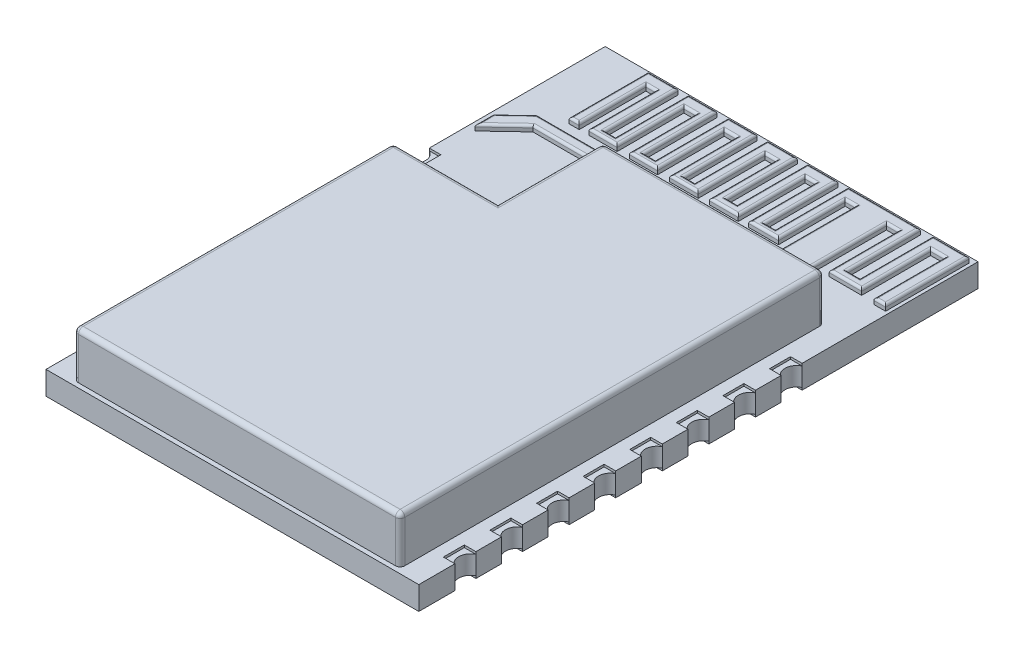
from build123d import *

# Parameters (mm, degrees)
EXTRUDE_1_DEPTH     = 1
CUT_EXTRUDE_1_DEPTH = 0.1
SKETCH_3_W          = 0.9999999999999991
SKETCH_3_H          = 0.9000000000000012
SKETCH_3_H_2        = 0.9000000000000021
SKETCH_3_W_2        = 1.0000000000000009
SKETCH_3_H_3        = 0.9000000000000017
SKETCH_3_H_4        = 0.9000000000000015
CUT_EXTRUDE_2_DEPTH = 0.1
CUT_EXTRUDE_3_DEPTH = 0.1
SKETCH_12_R         = 0.2
SKETCH_12_R_2       = 0.20000000000000023
SKETCH_12_R_3       = 0.1999999999999999
SKETCH_12_R_4       = 0.2000000000000001
SKETCH_12_R_5       = 0.19999999999999996
SKETCH_12_R_6       = 0.20000000000000007
CUT_EXTRUDE_4_DEPTH = 0.1
SKETCH_13_W         = 4.700000000000001
SKETCH_13_H         = 4.7
EXTRUDE_2_DEPTH     = 0.5
CUT_EXTRUDE_5_DEPTH = 0.1
SKETCH_16_R         = 0.2
SKETCH_16_R_2       = 0.19999999999999982
SKETCH_16_R_3       = 0.20000000000000004
SKETCH_16_R_4       = 0.19999999999999998
CUT_EXTRUDE_6_DEPTH = 0.25
EXTRUDE_4_DEPTH     = 2
CUT_EXTRUDE_7_DEPTH = 2
SKETCH_19_W         = 14
SKETCH_19_H         = 1.002469933908639
EXTRUDE_5_DEPTH     = 2
EXTRUDE_7_DEPTH     = 0.25
FILLET_1_R          = 0.2
FILLET_2_R          = 0.1


with BuildPart() as part:
    # 草圖1 → 填料-伸長1 (new body)
    with BuildSketch(Plane(origin=(0, 0, 0), x_dir=(1, 0, 0), z_dir=(0, 1, 0))):
        Polygon((-8, 12.000000000000002), (8, 12.000000000000002), (8.000000000000004, -11.999999999999998), (-7.9999999999999964, -11.999999999999998), align=None)
    extrude(amount=EXTRUDE_1_DEPTH)

    # 草圖2 → 除料-伸長1 (cut)
    with BuildSketch(Plane(origin=(0, 1, 0), x_dir=(1, 0, 0), z_dir=(0, 1, 0))):
        Polygon((-7.999999999999998, 2.4499977713717627), (-7.999999999999998, 1.5499977713717676), (-7.502985717330638, 1.5499977713717659), (-7.502985717330638, 2.449997771371764), align=None)
        Polygon((-7.999999999999998, 0.44999777137176267), (-7.999999999999998, -0.45000222862823236), (-7.502985717330638, -0.4500022286282341), (-7.502985717330638, 0.44999777137176394), align=None)
        Polygon((-7.999999999999998, -1.5500022286282373), (-7.999999999999998, -2.4500022286282324), (-7.502985717330637, -2.450002228628234), (-7.502985717330637, -1.550002228628236), align=None)
        Polygon((-7.999999999999997, -3.5500022286282373), (-7.999999999999997, -4.450002228628234), (-7.502985717330637, -4.450002228628234), (-7.502985717330637, -3.550002228628236), align=None)
        Polygon((-7.999999999999997, -5.550002228628239), (-7.999999999999997, -6.450002228628234), (-7.502985717330637, -6.450002228628234), (-7.502985717330637, -5.5500022286282364), align=None)
        Polygon((-7.999999999999997, -7.550002228628239), (-7.999999999999997, -8.450002228628234), (-7.5029857173306365, -8.450002228628234), (-7.5029857173306365, -7.5500022286282364), align=None)
        Polygon((-7.5029857173306365, -9.550002228628236), (-7.9999999999999964, -9.550002228628237), (-7.9999999999999964, -10.450002228628234), (-7.5029857173306365, -10.450002228628234), align=None)
        Polygon((7.5029857173306365, -10.450002228628234), (8.000000000000004, -10.450002228628232), (8.000000000000004, -9.550002228628237), (7.5029857173306365, -9.550002228628236), align=None)
        Polygon((7.5029857173306365, -8.450002228628234), (8.000000000000004, -8.450002228628232), (8.000000000000004, -7.550002228628238), (7.5029857173306365, -7.5500022286282364), align=None)
        Polygon((7.502985717330636, -6.450002228628234), (8.000000000000004, -6.450002228628232), (8.000000000000002, -5.550002228628238), (7.502985717330636, -5.5500022286282364), align=None)
        Polygon((7.502985717330636, -4.450002228628234), (8.000000000000002, -4.450002228628232), (8.000000000000002, -3.5500022286282373), (7.502985717330636, -3.550002228628236), align=None)
        Polygon((7.502985717330636, -2.450002228628234), (8.000000000000002, -2.4500022286282324), (8.000000000000002, -1.5500022286282373), (7.502985717330636, -1.550002228628236), align=None)
        Polygon((7.502985717330635, -0.4500022286282341), (8.000000000000002, -0.45000222862823236), (8.000000000000002, 0.44999777137176267), (7.502985717330635, 0.44999777137176394), align=None)
        Polygon((7.502985717330635, 3.549997771371766), (8.000000000000002, 3.5499977713717676), (8.000000000000002, 4.449997771371764), (7.502985717330635, 4.449997771371764), align=None)
        Polygon((7.502985717330635, 1.5499977713717659), (8.000000000000002, 1.5499977713717676), (8.000000000000002, 2.4499977713717627), (7.502985717330635, 2.449997771371764), align=None)
        Polygon((-7.502985717330638, 4.449997771371764), (-7.502985717330638, 3.549997771371766), (-8.002985717330638, 3.5499977713717676), (-8.002985717330638, 4.449997771371763), align=None)
    extrude(amount=-CUT_EXTRUDE_1_DEPTH, mode=Mode.SUBTRACT)

    # 草圖3 → 除料-伸長2 (cut)
    with BuildSketch(Plane.XZ):
        with Locations((7.5000000000000036, 7.999999999999998)):
            Rectangle(SKETCH_3_W, SKETCH_3_H)
        with Locations((7.5000000000000036, 9.999999999999998)):
            Rectangle(SKETCH_3_W, SKETCH_3_H_2)
        with Locations((7.5000000000000036, 5.999999999999998)):
            Rectangle(SKETCH_3_W_2, SKETCH_3_H)
        with Locations((7.5000000000000036, 3.9999999999999982)):
            Rectangle(SKETCH_3_W_2, SKETCH_3_H_3)
        with Locations((7.500000000000002, 1.9999999999999982)):
            Rectangle(SKETCH_3_W, SKETCH_3_H)
        with Locations((7.500000000000002, -1.75e-15)):
            Rectangle(SKETCH_3_W, SKETCH_3_H_4)
        with Locations((7.500000000000002, -2.0000000000000018)):
            Rectangle(SKETCH_3_W, SKETCH_3_H)
        with Locations((7.500000000000002, -4.000000000000002)):
            Rectangle(SKETCH_3_W, SKETCH_3_H_2)
        with Locations((-7.5000000000000036, 9.999999999999998)):
            Rectangle(SKETCH_3_W, SKETCH_3_H_2)
        with Locations((-7.500000000000002, -4.000000000000002)):
            Rectangle(SKETCH_3_W, SKETCH_3_H_2)
        with Locations((-7.500000000000002, -2.0000000000000018)):
            Rectangle(SKETCH_3_W, SKETCH_3_H)
        with Locations((-7.500000000000002, -1.75e-15)):
            Rectangle(SKETCH_3_W, SKETCH_3_H_4)
        with Locations((-7.500000000000002, 1.9999999999999982)):
            Rectangle(SKETCH_3_W, SKETCH_3_H)
        with Locations((-7.5000000000000036, 3.9999999999999982)):
            Rectangle(SKETCH_3_W_2, SKETCH_3_H_3)
        with Locations((-7.5000000000000036, 5.999999999999998)):
            Rectangle(SKETCH_3_W_2, SKETCH_3_H)
        with Locations((-7.5000000000000036, 7.999999999999998)):
            Rectangle(SKETCH_3_W, SKETCH_3_H)
    extrude(amount=-CUT_EXTRUDE_2_DEPTH, mode=Mode.SUBTRACT)

    # 草圖8 → 除料-伸長3 (cut)
    with BuildSketch(Plane(origin=(0, 1, 0), x_dir=(1, 0, 0), z_dir=(0, 1, 0))):
        Polygon((-0.9999999999999989, 0.6000000000000024), (3.7000000000000015, 0.6000000000000024), (3.700000000000002, -4.099999999999998), (-0.9999999999999983, -4.099999999999998), align=None)
    extrude(amount=-CUT_EXTRUDE_3_DEPTH, mode=Mode.SUBTRACT)

    # 草圖12 → 除料-伸長4 (cut)
    with BuildSketch(Plane(origin=(0, 0.9, 0), x_dir=(1, 0, 0), z_dir=(0, 1, 0))):
        with Locations(Location((-0.5099999999999989, -3.6499999999999977, 0), (0, 0, 270))):
            Circle(SKETCH_12_R)
        with Locations(Location((0.4200000000000011, -3.6499999999999977, 0), (0, 0, 270))):
            Circle(SKETCH_12_R)
        with Locations(Location((1.3500000000000012, -3.6499999999999977, 0), (0, 0, 270))):
            Circle(SKETCH_12_R)
        with Locations(Location((2.2800000000000007, -3.6499999999999977, 0), (0, 0, 270))):
            Circle(SKETCH_12_R_2)
        with Locations(Location((3.210000000000001, -3.6499999999999977, 0), (0, 0, 270))):
            Circle(SKETCH_12_R_2)
        with Locations(Location((-0.509999999999999, -2.7199999999999975, 0), (0, 0, 270))):
            Circle(SKETCH_12_R_3)
        with Locations(Location((0.420000000000001, -2.7199999999999975, 0), (0, 0, 270))):
            Circle(SKETCH_12_R_3)
        with Locations(Location((1.350000000000001, -2.7199999999999975, 0), (0, 0, 270))):
            Circle(SKETCH_12_R_3)
        with Locations(Location((2.2800000000000007, -2.7199999999999975, 0), (0, 0, 270))):
            Circle(SKETCH_12_R_4)
        with Locations(Location((3.210000000000001, -2.7199999999999975, 0), (0, 0, 270))):
            Circle(SKETCH_12_R_4)
        with Locations(Location((-0.5099999999999991, -1.7899999999999978, 0), (0, 0, 270))):
            Circle(SKETCH_12_R_5)
        with Locations(Location((0.4200000000000008, -1.7899999999999978, 0), (0, 0, 270))):
            Circle(SKETCH_12_R_6)
        with Locations(Location((1.350000000000001, -1.7899999999999978, 0), (0, 0, 270))):
            Circle(SKETCH_12_R)
        with Locations(Location((2.2800000000000002, -1.7899999999999978, 0), (0, 0, 270))):
            Circle(SKETCH_12_R_2)
        with Locations(Location((3.2100000000000004, -1.7899999999999978, 0), (0, 0, 270))):
            Circle(SKETCH_12_R_2)
        with Locations(Location((-0.5099999999999993, -0.8599999999999979, 0), (0, 0, 270))):
            Circle(SKETCH_12_R_6)
        with Locations(Location((0.4200000000000007, -0.8599999999999979, 0), (0, 0, 270))):
            Circle(SKETCH_12_R_5)
        with Locations(Location((1.3500000000000008, -0.8599999999999979, 0), (0, 0, 270))):
            Circle(SKETCH_12_R)
        with Locations(Location((2.2800000000000002, -0.8599999999999979, 0), (0, 0, 270))):
            Circle(SKETCH_12_R_2)
        with Locations(Location((3.2100000000000004, -0.8599999999999979, 0), (0, 0, 270))):
            Circle(SKETCH_12_R_2)
        with Locations(Location((-0.5099999999999995, 0.07000000000000235, 0), (0, 0, 270))):
            Circle(SKETCH_12_R_6)
        with Locations(Location((0.4200000000000006, 0.07000000000000235, 0), (0, 0, 270))):
            Circle(SKETCH_12_R_5)
        with Locations(Location((1.3500000000000008, 0.07000000000000235, 0), (0, 0, 270))):
            Circle(SKETCH_12_R)
        with Locations(Location((2.2800000000000002, 0.07000000000000235, 0), (0, 0, 270))):
            Circle(SKETCH_12_R_2)
        with Locations(Location((3.2100000000000004, 0.07000000000000235, 0), (0, 0, 270))):
            Circle(SKETCH_12_R_2)
    extrude(amount=-CUT_EXTRUDE_4_DEPTH, mode=Mode.SUBTRACT)

    # 草圖13 → 填料-伸長2 (add)
    with BuildSketch(Plane(origin=(0, 1, 0), x_dir=(1, 0, 0), z_dir=(0, 1, 0))):
        with Locations((1.3500000000000016, -1.7499999999999978)):
            Rectangle(SKETCH_13_W, SKETCH_13_H)
    extrude(amount=-EXTRUDE_2_DEPTH)

    # 草圖15 → 除料-伸長5 (cut)
    with BuildSketch(Plane.XZ):
        Polygon((1.0000000000000018, -0.6000000000000014), (-3.6999999999999984, -0.6000000000000021), (-3.6999999999999984, 4.099999999999997), (1.000000000000002, 4.099999999999998), align=None)
    extrude(amount=-CUT_EXTRUDE_5_DEPTH, mode=Mode.SUBTRACT)

    # 草圖16 → 除料-伸長6 (cut)
    with BuildSketch(Plane.XZ):
        with Locations(Location((0.5100000000000018, 3.6099999999999977, 0), (0, 0, 270))):
            Circle(SKETCH_16_R)
        with Locations(Location((-0.41999999999999826, 3.6099999999999977, 0), (0, 0, 270))):
            Circle(SKETCH_16_R)
        with Locations(Location((-1.3499999999999983, 3.609999999999997, 0), (0, 0, 270))):
            Circle(SKETCH_16_R)
        with Locations(Location((-2.279999999999998, 3.609999999999997, 0), (0, 0, 270))):
            Circle(SKETCH_16_R_2)
        with Locations(Location((-3.2099999999999986, 3.6099999999999968, 0), (0, 0, 270))):
            Circle(SKETCH_16_R_2)
        with Locations(Location((-3.2099999999999986, 2.679999999999997, 0), (0, 0, 270))):
            Circle(SKETCH_16_R_2)
        with Locations(Location((-2.279999999999998, 2.6799999999999975, 0), (0, 0, 270))):
            Circle(SKETCH_16_R_2)
        with Locations(Location((-1.3499999999999983, 2.6799999999999975, 0), (0, 0, 270))):
            Circle(SKETCH_16_R)
        with Locations(Location((-0.4199999999999983, 2.679999999999998, 0), (0, 0, 270))):
            Circle(SKETCH_16_R)
        with Locations(Location((0.5100000000000018, 2.679999999999998, 0), (0, 0, 270))):
            Circle(SKETCH_16_R)
        with Locations(Location((-3.2099999999999986, 1.749999999999997, 0), (0, 0, 270))):
            Circle(SKETCH_16_R_2)
        with Locations(Location((-2.279999999999998, 1.7499999999999973, 0), (0, 0, 270))):
            Circle(SKETCH_16_R_2)
        with Locations(Location((-1.3499999999999983, 1.7499999999999973, 0), (0, 0, 270))):
            Circle(SKETCH_16_R)
        with Locations(Location((-0.4199999999999984, 1.7499999999999978, 0), (0, 0, 270))):
            Circle(SKETCH_16_R_3)
        with Locations(Location((0.5100000000000017, 1.7499999999999978, 0), (0, 0, 270))):
            Circle(SKETCH_16_R)
        with Locations(Location((-3.2099999999999986, 0.819999999999997, 0), (0, 0, 270))):
            Circle(SKETCH_16_R_2)
        with Locations(Location((-2.279999999999998, 0.8199999999999974, 0), (0, 0, 270))):
            Circle(SKETCH_16_R_2)
        with Locations(Location((-1.3499999999999985, 0.8199999999999974, 0), (0, 0, 270))):
            Circle(SKETCH_16_R)
        with Locations(Location((-0.4199999999999984, 0.8199999999999978, 0), (0, 0, 270))):
            Circle(SKETCH_16_R_4)
        with Locations(Location((0.5100000000000017, 0.8199999999999978, 0), (0, 0, 270))):
            Circle(SKETCH_16_R)
        with Locations(Location((-3.2099999999999986, -0.11000000000000289, 0), (0, 0, 270))):
            Circle(SKETCH_16_R_2)
        with Locations(Location((-2.279999999999998, -0.11000000000000246, 0), (0, 0, 270))):
            Circle(SKETCH_16_R_2)
        with Locations(Location((-1.3499999999999985, -0.11000000000000246, 0), (0, 0, 270))):
            Circle(SKETCH_16_R)
        with Locations(Location((-0.41999999999999843, -0.11000000000000203, 0), (0, 0, 270))):
            Circle(SKETCH_16_R)
        with Locations(Location((0.5100000000000016, -0.11000000000000203, 0), (0, 0, 270))):
            Circle(SKETCH_16_R)
    extrude(amount=-CUT_EXTRUDE_6_DEPTH, mode=Mode.SUBTRACT)

    # 草圖17 → 填料-伸長4 (add)
    with BuildSketch(Plane(origin=(0, 1, 0), x_dir=(1, 0, 0), z_dir=(0, 1, 0))):
        Polygon((-2.500000000000001, 6.400000000000003), (7.000000000000003, 6.400000000000002), (7.000000000000003, -10.799999999999999), (-6.999999999999997, -10.799999999999999), (-6.999999999999999, 1.400000000000001), (-6.999999999999999, 1.9000000000000024), (-2.5000000000000004, 1.9000000000000032), align=None)
    extrude(amount=EXTRUDE_4_DEPTH)

    # 草圖18 → 除料-伸長7 (cut)
    with BuildSketch(Plane(origin=(0, 1, 0), x_dir=(1, 0, 0), z_dir=(0, 1, 0))):
        with BuildLine():
            Line((-8, 4.449997771371763), (-7.999999999999998, 3.549997771371766))
            ThreePointArc((-7.999999999999998, 3.549997771371766), (-7.717944947177037, 3.999997771371765), (-8, 4.449997771371763))
        make_face()
        with BuildLine():
            Line((-8, 2.4499977713717622), (-7.999999999999998, 1.5499977713717659))
            ThreePointArc((-7.999999999999998, 1.5499977713717659), (-7.717944947177038, 1.999997771371765), (-8, 2.4499977713717622))
        make_face()
        with BuildLine():
            Line((-8, 0.4499977713717622), (-7.999999999999998, -0.4500022286282341))
            ThreePointArc((-7.999999999999998, -0.4500022286282341), (-7.717944947177038, -2.22862823506e-06), (-8, 0.4499977713717622))
        make_face()
        with BuildLine():
            Line((-8, -1.5500022286282378), (-7.999999999999998, -2.450002228628234))
            ThreePointArc((-7.999999999999998, -2.450002228628234), (-7.717944947177037, -2.0000022286282353), (-8, -1.5500022286282378))
        make_face()
        with BuildLine():
            Line((-8, -3.5500022286282378), (-7.999999999999998, -4.450002228628234))
            ThreePointArc((-7.999999999999998, -4.450002228628234), (-7.717944947177038, -4.000002228628235), (-8, -3.5500022286282378))
        make_face()
        with BuildLine():
            Line((-8, -5.550002228628238), (-7.999999999999998, -6.450002228628234))
            ThreePointArc((-7.999999999999998, -6.450002228628234), (-7.717944947177038, -6.000002228628235), (-8, -5.550002228628238))
        make_face()
        with BuildLine():
            Line((-8, -7.550002228628238), (-7.999999999999998, -8.450002228628234))
            ThreePointArc((-7.999999999999998, -8.450002228628234), (-7.717944947177037, -8.000002228628235), (-8, -7.550002228628238))
        make_face()
        with BuildLine():
            Line((-8, -9.550002228628237), (-7.999999999999998, -10.450002228628234))
            ThreePointArc((-7.999999999999998, -10.450002228628234), (-7.717944947177038, -10.000002228628235), (-8, -9.550002228628237))
        make_face()
        with BuildLine():
            Line((8, 4.449997771371763), (7.999999999999998, 3.549997771371766))
            ThreePointArc((7.999999999999998, 3.549997771371766), (7.717944947177037, 3.999997771371765), (8, 4.449997771371763))
        make_face()
        with BuildLine():
            Line((8, 2.4499977713717622), (7.999999999999998, 1.5499977713717659))
            ThreePointArc((7.999999999999998, 1.5499977713717659), (7.717944947177038, 1.999997771371765), (8, 2.4499977713717622))
        make_face()
        with BuildLine():
            Line((8, 0.4499977713717622), (7.999999999999998, -0.4500022286282341))
            ThreePointArc((7.999999999999998, -0.4500022286282341), (7.717944947177038, -2.228628235e-06), (8, 0.4499977713717622))
        make_face()
        with BuildLine():
            Line((8, -1.5500022286282378), (7.999999999999998, -2.450002228628234))
            ThreePointArc((7.999999999999998, -2.450002228628234), (7.717944947177037, -2.0000022286282353), (8, -1.5500022286282378))
        make_face()
        with BuildLine():
            Line((8, -3.5500022286282378), (7.999999999999998, -4.450002228628234))
            ThreePointArc((7.999999999999998, -4.450002228628234), (7.717944947177038, -4.000002228628235), (8, -3.5500022286282378))
        make_face()
        with BuildLine():
            Line((8, -5.550002228628238), (7.999999999999998, -6.450002228628234))
            ThreePointArc((7.999999999999998, -6.450002228628234), (7.717944947177038, -6.000002228628235), (8, -5.550002228628238))
        make_face()
        with BuildLine():
            Line((8, -7.550002228628238), (7.999999999999998, -8.450002228628234))
            ThreePointArc((7.999999999999998, -8.450002228628234), (7.717944947177037, -8.000002228628235), (8, -7.550002228628238))
        make_face()
        with BuildLine():
            Line((8, -9.550002228628237), (7.999999999999998, -10.450002228628234))
            ThreePointArc((7.999999999999998, -10.450002228628234), (7.717944947177038, -10.000002228628235), (8, -9.550002228628237))
        make_face()
    extrude(amount=-CUT_EXTRUDE_7_DEPTH, mode=Mode.SUBTRACT)

    # 草圖19 → 填料-伸長5 (add)
    with BuildSketch(Plane(origin=(0, 1, 0), x_dir=(1, 0, 0), z_dir=(0, 1, 0))):
        with Locations((2.22e-15, -11.301234966954318)):
            Rectangle(SKETCH_19_W, SKETCH_19_H)
    extrude(amount=EXTRUDE_5_DEPTH)

    # 草圖20 → 填料-伸長7 (add)
    with BuildSketch(Plane(origin=(0, 1, 0), x_dir=(1, 0, 0), z_dir=(0, 1, 0))):
        Polygon((2.7745772280204366, 7.299411594104662), (2.774577228020436, 6.400000000000003), (2.2500000000000013, 6.400000000000003), (2.2333276157297033, 7.273314493037537), (-6.374311063944464, 7.2733144930375415), (-7.5709253757125925, 6.142787441828224), (-7.65515008486728, 6.06321434033413), (-7.65515008486728, 6.074907724951117), (-7.65515008486728, 6.142787441828224), (-7.65515008486728, 6.849705797052333), (-6.687394800885329, 7.764013370288473), (3.5229671278681067, 7.7640133702884695), (3.5229671278681067, 11.214195737954471), (3.088020932820037, 11.214195737954471), (3.088020932820037, 8.351190733603364), (1.8049296574282336, 8.351190733603364), (1.8049296574282336, 11.214195737954471), (1.359109807503962, 11.214195737954471), (1.359109807503962, 8.351190733603364), (0.11951315161696369, 8.351190733603364), (0.11951315161696369, 11.214195737954471), (-0.35892766293591294, 11.214195737954471), (-0.35892766293591294, 8.351190733603364), (-1.5876506639467096, 8.351190733603364), (-1.5876506639467096, 11.214195737954471), (-2.109586098004393, 11.214195737954471), (-2.109586098004393, 8.351190733603364), (-3.3165617892627863, 8.351190733603364), (-3.3165617892627863, 11.214195737954471), (-3.8384972233204695, 11.214195737954471), (-3.8384972233204695, 8.351190733603364), (-5.056346569455065, 8.351190733603364), (-5.056346569455065, 11.214195737954471), (-5.4695454547507305, 11.214195737954471), (-5.4695454547507305, 8.351190733603364), (-5.904491649798801, 8.351190733603364), (-5.904491649798801, 11.75561570856587), (-4.632274029283196, 11.75561570856587), (-4.632274029283196, 8.628639143606161), (-4.185197948571669, 8.628639143606161), (-4.185197948571669, 11.75561570856587), (-2.9587159743295213, 11.75561570856587), (-2.9587159743295213, 8.628639143606161), (-2.4725429394947964, 8.628639143606161), (-2.4725429394947964, 11.75561570856587), (-1.235011578097315, 11.75561570856587), (-1.235011578097315, 8.628639143606161), (-0.7819867047285942, 8.628639143606161), (-0.7819867047285942, 11.75561570856587), (0.4886928181348912, 11.75561570856587), (0.4886928181348912, 8.728083628004175), (0.9417176915036121, 8.728083628004175), (0.9417176915036121, 11.75561570856587), (2.2344959886777684, 11.75561570856587), (2.2344959886777684, 8.628639143606161), (2.6764714748911547, 8.628639143606161), (2.6764714748911547, 11.75561570856587), (5.770299878384859, 11.75561570856587), (5.770299878384859, 8.628639143606161), (5.858694975627536, 8.628639143606161), (6.3117198489962565, 8.628639143606161), (6.3117198489962565, 11.75561570856587), (7.8586340507431105, 11.75561570856587), (7.8586340507431105, 8.17561427023744), (7.350362241597716, 8.17561427023744), (7.350362241597716, 11.214195737954471), (6.7536953352096445, 11.214195737954471), (6.7536953352096445, 8.252959980324784), (5.361472553637476, 8.252959980324784), (5.361472553637476, 11.214195737954471), (4.855655638179534, 11.214195737954471), (4.855655638179534, 7.299411594104662), align=None)
    extrude(amount=EXTRUDE_7_DEPTH)

    # 圓角1
    fillet_1_edges = [part.edges().sort_by_distance(p)[0] for p in [
        (7.000000000000003, 2, -6.400000000000002),
        (-2.500000000000001, 2, -6.400000000000003),
        (-6.999999999999999, 2, -1.9000000000000024),
        (7.000000000000003, 3, 2.701234966954317),
        (2.250000000000001, 3, -6.400000000000002),
        (-2.500000000000001, 3, -4.150000000000003),
        (-4.75, 3, -1.9000000000000028),
        (-6.999999999999998, 3, 4.951234966954317),
        (2.66e-15, 3, 11.802469933908636),
        (7.000000000000003, 2, 11.802469933908636),
        (-6.999999999999997, 2, 11.802469933908636),
    ]]
    fillet(fillet_1_edges, radius=FILLET_1_R)

    # 圓角2
    fillet_2_edges = [part.edges().sort_by_distance(p)[0] for p in [
        (-7.014730574405872, 1.25, -6.668264416685836),
        (2.2500000000000013, 1.125, -6.400000000000003),
        (2.7745772280204366, 1.25, -6.849705797052332),
        (2.774577228020436, 1.125, -6.400000000000003),
        (3.5229671278681067, 1.25, -9.48910455412147),
        (-1.5822138365086111, 1.25, -7.764013370288471),
        (-7.171272442876305, 1.25, -7.306859583670403),
        (-7.65515008486728, 1.25, -6.456460068693231),
        (-2.0704917241073804, 1.25, -7.273314493037539),
        (2.2416638078648523, 1.25, -6.8366572465187705),
        (2.5122886140102185, 1.25, -6.400000000000003),
        (3.815116433099985, 1.25, -7.299411594104662),
        (4.855655638179534, 1.25, -9.256803666029565),
        (5.1085640959085055, 1.25, -11.214195737954471),
        (5.361472553637476, 1.25, -9.733577859139627),
        (6.057583944423561, 1.25, -8.252959980324784),
        (6.7536953352096445, 1.25, -9.733577859139627),
        (7.05202878840368, 1.25, -11.214195737954471),
        (7.350362241597716, 1.25, -9.694905004095956),
        (7.604498146170413, 1.25, -8.17561427023744),
        (7.8586340507431105, 1.25, -9.965614989401654),
        (7.085176949869684, 1.25, -11.75561570856587),
        (6.3117198489962565, 1.25, -10.192127426086016),
        (6.041009863690558, 1.25, -8.628639143606161),
        (5.770299878384859, 1.25, -10.192127426086016),
        (4.2233856766380065, 1.25, -11.75561570856587),
        (2.6764714748911547, 1.25, -10.192127426086016),
        (2.4554837317844616, 1.25, -8.628639143606161),
        (2.2344959886777684, 1.25, -10.192127426086016),
        (1.5881068400906901, 1.25, -11.75561570856587),
        (0.9417176915036121, 1.25, -10.241849668285022),
        (0.7152052548192516, 1.25, -8.728083628004175),
        (0.4886928181348912, 1.25, -10.241849668285022),
        (-0.14664694329685157, 1.25, -11.75561570856587),
        (-0.7819867047285942, 1.25, -10.192127426086016),
        (-1.0084991414129547, 1.25, -8.628639143606161),
        (-1.235011578097315, 1.25, -10.192127426086016),
        (-1.8537772587960557, 1.25, -11.75561570856587),
        (-2.4725429394947964, 1.25, -10.192127426086016),
        (-2.7156294569121586, 1.25, -8.628639143606161),
        (-2.9587159743295213, 1.25, -10.192127426086016),
        (-3.571956961450595, 1.25, -11.75561570856587),
        (-4.185197948571669, 1.25, -10.192127426086016),
        (-4.4087359889274325, 1.25, -8.628639143606161),
        (-4.632274029283196, 1.25, -10.192127426086016),
        (-5.268382839540998, 1.25, -11.75561570856587),
        (-5.904491649798801, 1.25, -10.053403221084617),
        (-5.687018552274766, 1.25, -8.351190733603364),
        (-5.4695454547507305, 1.25, -9.782693235778918),
        (-5.262946012102898, 1.25, -11.214195737954471),
        (-5.056346569455065, 1.25, -9.782693235778918),
        (-4.447421896387767, 1.25, -8.351190733603364),
        (-3.8384972233204695, 1.25, -9.782693235778918),
        (-3.577529506291628, 1.25, -11.214195737954471),
        (-3.3165617892627863, 1.25, -9.782693235778918),
        (-2.7130739436335896, 1.25, -8.351190733603364),
        (-2.109586098004393, 1.25, -9.782693235778918),
        (-1.8486183809755512, 1.25, -11.214195737954471),
        (-1.5876506639467096, 1.25, -9.782693235778918),
        (-0.9732891634413113, 1.25, -8.351190733603364),
        (-0.35892766293591294, 1.25, -9.782693235778918),
        (-0.11970725565947463, 1.25, -11.214195737954471),
        (0.11951315161696369, 1.25, -9.782693235778918),
        (0.7393114795604628, 1.25, -8.351190733603364),
        (1.359109807503962, 1.25, -9.782693235778918),
        (1.5820197324660978, 1.25, -11.214195737954471),
        (1.8049296574282336, 1.25, -9.782693235778918),
        (2.4464752951241353, 1.25, -8.351190733603364),
        (3.088020932820037, 1.25, -9.782693235778918),
        (3.3054940303440716, 1.25, -11.214195737954471),
    ]]
    fillet(fillet_2_edges, radius=FILLET_2_R)


solid = part.part
